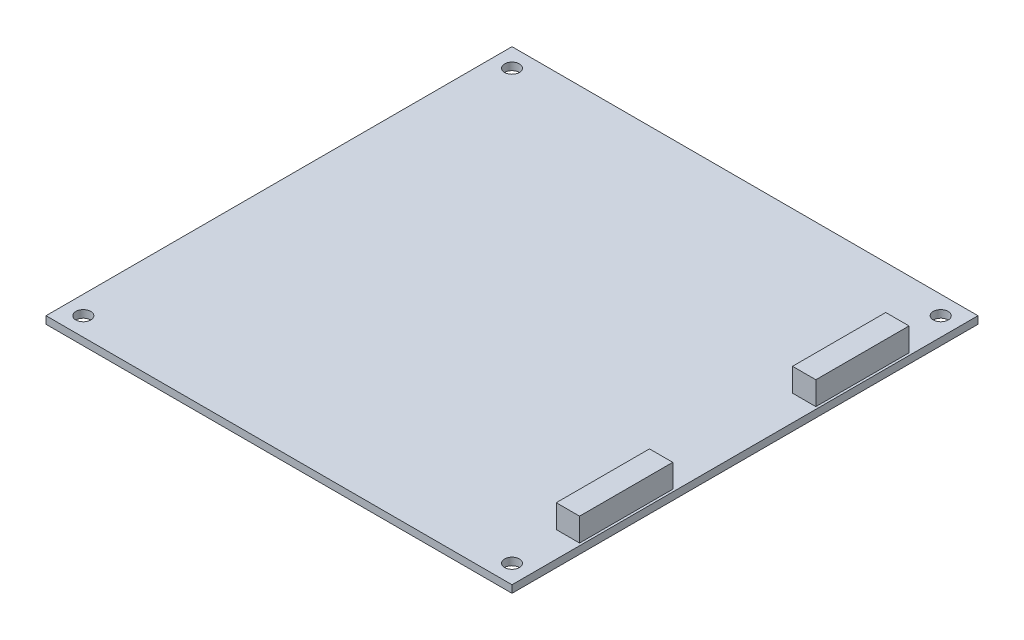
from build123d import *

# Parameters (mm, degrees)
SKETCH1_W           = 100
SKETCH1_H           = 100
BOSS_EXTRUDE1_DEPTH = 1.6
SKETCH2_R           = 1.6
CUT_EXTRUDE1_DEPTH  = 71.728777736
SKETCH3_W           = 5
SKETCH3_H           = 20
BOSS_EXTRUDE2_DEPTH = 5


with BuildPart() as part:
    # Sketch1 → Boss-Extrude1 (new body)
    with BuildSketch(Plane(origin=(0, 0, 0), x_dir=(1, 0, 0), z_dir=(0, 1, 0))):
        Rectangle(SKETCH1_W, SKETCH1_H)
    extrude(amount=BOSS_EXTRUDE1_DEPTH)

    # Sketch2 → Cut-Extrude1 (cut, through all)
    with BuildSketch(Plane(origin=(0, 1.6, 0), x_dir=(1, 0, 0), z_dir=(0, 1, 0))):
        with Locations(Location((-46, -46, 0), (0, 0, 270))):
            Circle(SKETCH2_R)
        with Locations(Location((-46, 46, 0), (0, 0, 270))):
            Circle(SKETCH2_R)
        with Locations(Location((46, 46, 0), (0, 0, 270))):
            Circle(SKETCH2_R)
        with Locations(Location((46, -46, 0), (0, 0, 270))):
            Circle(SKETCH2_R)
    extrude(amount=-CUT_EXTRUDE1_DEPTH, mode=Mode.SUBTRACT)

    # Sketch3 → Boss-Extrude2 (add)
    with BuildSketch(Plane(origin=(0, 1.6, 0), x_dir=(1, 0, 0), z_dir=(0, 1, 0))):
        with Locations((47, -25)):
            Rectangle(SKETCH3_W, SKETCH3_H)
        with Locations((47, 25.7)):
            Rectangle(SKETCH3_W, SKETCH3_H)
    extrude(amount=BOSS_EXTRUDE2_DEPTH)


solid = part.part
